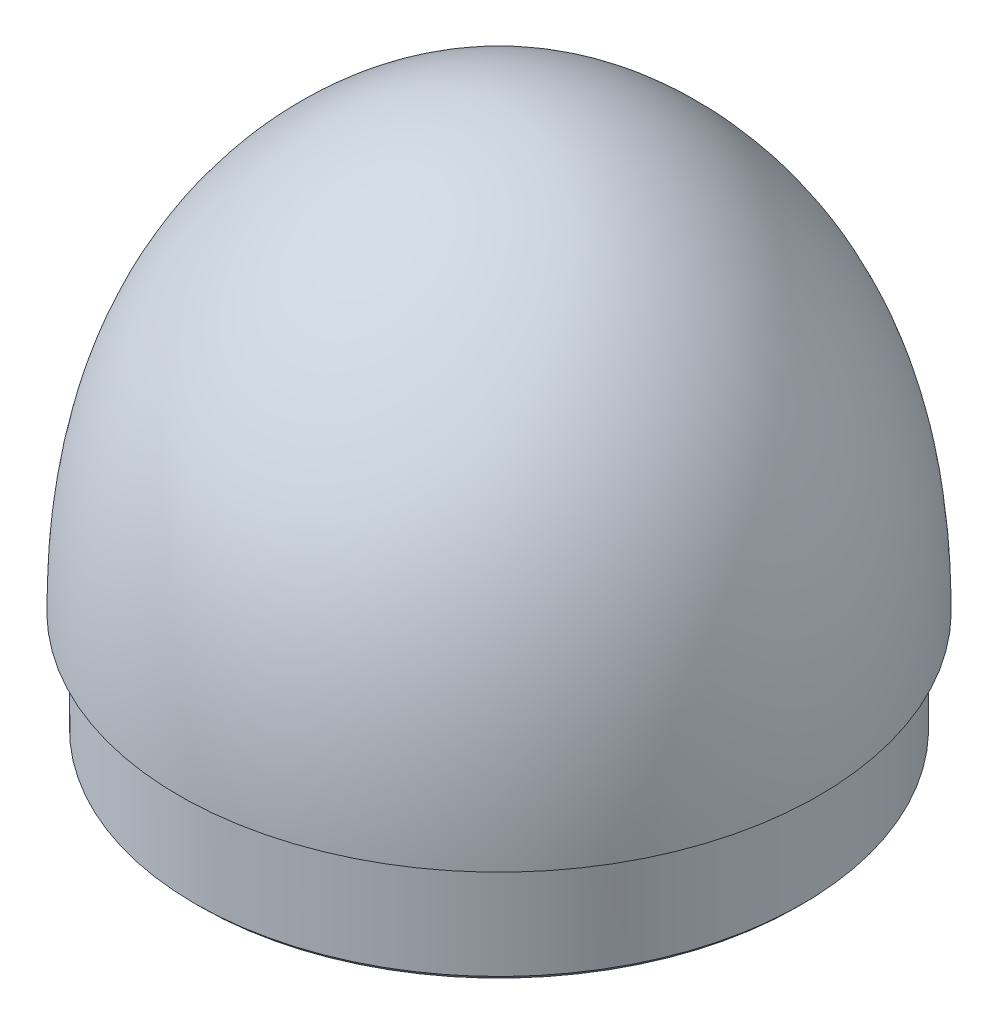
from build123d import *

# Parameters (mm, degrees)
BOSS_EXTRUDE2_DEPTH = 5
CHAMFER1_SIZE       = 0.7
FILLET1_R           = 2


with BuildPart() as part:
    # Sketch3 → Revolve1 (revolve)
    with BuildSketch(Plane.XY, mode=Mode.PRIVATE) as revolve1_sk:
        with BuildLine():
            Line((-41.25, 0), (-42.75, 0))
            Line((-42.75, 0), (-42.75, 15))
            Line((-42.75, 15), (-45, 15))
            add(Edge.make_bspline(
                [(-45, 15), (-45, 33.63701026), (-37.623115354, 59.484821268), (-12.301870518, 76.047426191), (0, 76.047426191)],
                knots=[0, 0, 0, 0, 0.584889903, 1, 1, 1, 1], degree=3))
            Line((0, 76.047426191), (0, 74.547426191))
            add(Edge.make_bspline(
                [(-43.490429879, 16.5), (-43.47825423, 17.447352), (-43.4296633, 19.355844405), (-43.235850844, 23.056930634), (-42.807900532, 27.545595426), (-41.986633297, 32.689505156), (-40.466663576, 39.238041503), (-37.743043327, 46.847747671), (-33.842433939, 53.728397249), (-29.961040028, 58.81673956), (-25.547541887, 63.646152056), (-20.393205683, 67.904061547), (-14.619902999, 71.183472612), (-10.010485444, 73.05966314), (-5.95200064, 74.059562605), (-2.594649158, 74.475411437), (-0.861029569, 74.547426191), (0, 74.547426191)],
                knots=[0.015975596, 0.015975596, 0.015975596, 0.015975596, 0.046726359, 0.077477122, 0.138978647, 0.200480172, 0.261981697, 0.384984748, 0.507987798, 0.569489323, 0.630990849, 0.753993899, 0.815495424, 0.87699695, 0.938498475, 0.969249237, 1, 1, 1, 1], degree=3))
            Line((-43.490429879, 16.5), (-42.75, 16.5))
            Line((-42.75, 16.5), (-41.25, 16.5))
            Line((-41.25, 16.5), (-41.25, 15))
            Line((-41.25, 15), (-41.25, 0))
        make_face()
    revolve(revolve1_sk.sketch.rotate(Axis((0, 0, 0), (0, 1, 0)), 270), axis=Axis((0, 0, 0), (0, 1, 0)))

    # Sketch4 → Boss-Extrude2 (add)
    with BuildSketch(Plane.XZ):
        with BuildLine():
            Line((-41.055602541, 4), (-4, 4))
            Line((-4, 4), (-4, 41.055602541))
            ThreePointArc((-4, 41.055602541), (0, 41.25), (4, 41.055602541))
            Line((4, 41.055602541), (4, 4))
            Line((4, 4), (41.055602541, 4))
            ThreePointArc((41.055602541, 4), (41.25, 0), (41.055602541, -4))
            Line((41.055602541, -4), (4, -4))
            Line((4, -4), (4, -41.055602541))
            ThreePointArc((4, -41.055602541), (0, -41.25), (-4, -41.055602541))
            Line((-4, -41.055602541), (-4, -4))
            Line((-4, -4), (-41.055602541, -4))
            ThreePointArc((-41.055602541, -4), (-41.25, 0), (-41.055602541, 4))
        make_face()
    extrude(amount=-BOSS_EXTRUDE2_DEPTH)

    # Chamfer1
    chamfer1_edges = [part.edges().sort_by_distance(p)[0] for p in [
        (0, 0, 42.75),
    ]]
    chamfer(chamfer1_edges, length=CHAMFER1_SIZE)

    # Fillet1
    fillet1_edges = [part.edges().sort_by_distance(p)[0] for p in [
        (-22.52780127, 5, 4),
        (-4, 5, 22.52780127),
        (4, 5, 22.52780127),
        (22.52780127, 5, 4),
        (22.52780127, 5, -4),
        (4, 5, -22.52780127),
        (-4, 5, -22.52780127),
        (-22.52780127, 5, -4),
        (-22.52780127, 0, -4),
        (-4, 0, -22.52780127),
        (4, 0, -22.52780127),
        (22.52780127, 0, -4),
        (22.52780127, 0, 4),
        (4, 0, 22.52780127),
        (-4, 0, 22.52780127),
        (-22.52780127, 0, 4),
    ]]
    fillet(fillet1_edges, radius=FILLET1_R)


solid = part.part
